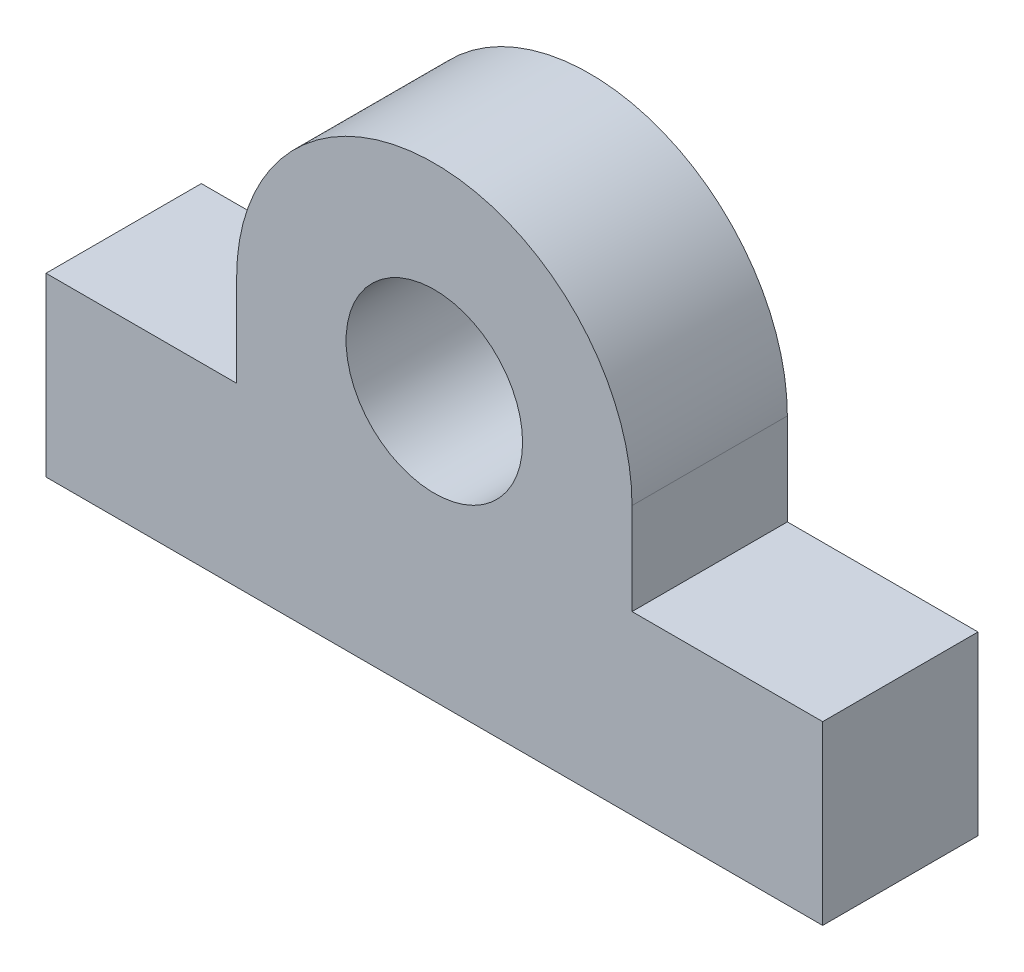
from build123d import *

# Parameters (mm, degrees)
SKETCH1_R           = 12.5
BOSS_EXTRUDE1_DEPTH = 11


with BuildPart() as part:
    # Sketch1 → Boss-Extrude1 (new, symmetric)
    with BuildSketch(Plane.XY):
        with BuildLine():
            Line((-55, 0), (55, 0))
            Line((55, 0), (55, 25))
            Line((55, 25), (28, 25))
            Line((28, 25), (28, 38))
            ThreePointArc((28, 38), (0, 66), (-28, 38))
            Line((-28, 38), (-28, 25))
            Line((-28, 25), (-55, 25))
            Line((-55, 25), (-55, 0))
        make_face()
        with Locations((0, 38)):
            Circle(SKETCH1_R, mode=Mode.SUBTRACT)
    extrude(amount=BOSS_EXTRUDE1_DEPTH, both=True)


solid = part.part
